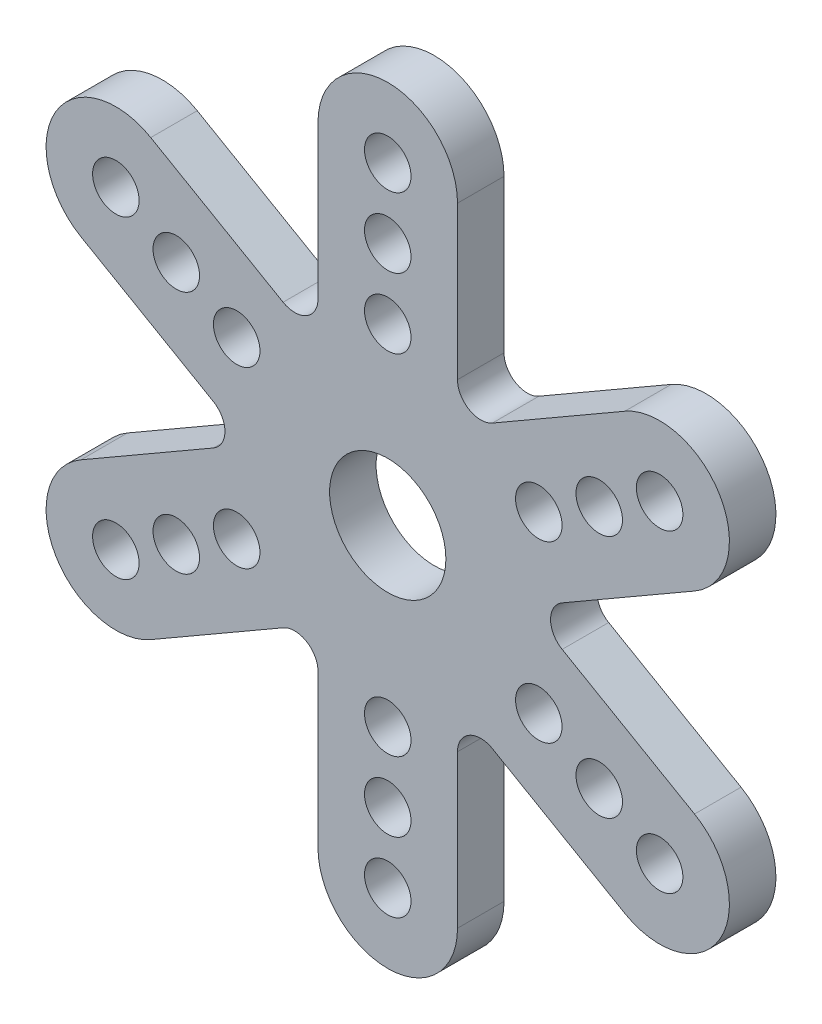
from build123d import *

# Parameters (mm, degrees)
SKETCH1_R      = 2.5
SKETCH1_R_2    = 1
EXTRUDE1_DEPTH = 2
FILLET1_R      = 1


with BuildPart() as part:
    # Sketch1 → Extrude1 (new body)
    with BuildSketch(Plane.XY):
        with BuildLine():
            Line((3, 13.5), (3, 5.196152423))
            Line((3, 5.196152423), (10.191342951, 9.348076211))
            ThreePointArc((10.191342951, 9.348076211), (14.289419162, 8.25), (13.191342951, 4.151923789))
            Line((13.191342951, 4.151923789), (6, 0))
            Line((6, 0), (13.191342951, -4.151923789))
            ThreePointArc((13.191342951, -4.151923789), (14.289419162, -8.25), (10.191342951, -9.348076211))
            Line((10.191342951, -9.348076211), (3, -5.196152423))
            Line((3, -5.196152423), (3, -13.5))
            ThreePointArc((3, -13.5), (0, -16.5), (-3, -13.5))
            Line((-3, -13.5), (-3, -5.196152423))
            Line((-3, -5.196152423), (-10.191342951, -9.348076211))
            ThreePointArc((-10.191342951, -9.348076211), (-14.289419162, -8.25), (-13.191342951, -4.151923789))
            Line((-13.191342951, -4.151923789), (-6, 0))
            Line((-6, 0), (-13.191342951, 4.151923789))
            ThreePointArc((-13.191342951, 4.151923789), (-14.289419162, 8.25), (-10.191342951, 9.348076211))
            Line((-10.191342951, 9.348076211), (-3, 5.196152423))
            Line((-3, 5.196152423), (-3, 13.5))
            ThreePointArc((-3, 13.5), (0, 16.5), (3, 13.5))
        make_face()
        Circle(SKETCH1_R, mode=Mode.SUBTRACT)
        with Locations((0, 7.5)):
            Circle(SKETCH1_R_2, mode=Mode.SUBTRACT)
        with Locations((0, 10.5)):
            Circle(SKETCH1_R_2, mode=Mode.SUBTRACT)
        with Locations((0, 13.5)):
            Circle(SKETCH1_R_2, mode=Mode.SUBTRACT)
        with Locations((-6.495190528, 3.75)):
            Circle(SKETCH1_R_2, mode=Mode.SUBTRACT)
        with Locations((-9.09326674, 5.25)):
            Circle(SKETCH1_R_2, mode=Mode.SUBTRACT)
        with Locations((-11.691342951, 6.75)):
            Circle(SKETCH1_R_2, mode=Mode.SUBTRACT)
        with Locations((-6.495190528, -3.75)):
            Circle(SKETCH1_R_2, mode=Mode.SUBTRACT)
        with Locations((-9.09326674, -5.25)):
            Circle(SKETCH1_R_2, mode=Mode.SUBTRACT)
        with Locations((-11.691342951, -6.75)):
            Circle(SKETCH1_R_2, mode=Mode.SUBTRACT)
        with Locations((0, -7.5)):
            Circle(SKETCH1_R_2, mode=Mode.SUBTRACT)
        with Locations((0, -10.5)):
            Circle(SKETCH1_R_2, mode=Mode.SUBTRACT)
        with Locations((0, -13.5)):
            Circle(SKETCH1_R_2, mode=Mode.SUBTRACT)
        with Locations((6.495190528, -3.75)):
            Circle(SKETCH1_R_2, mode=Mode.SUBTRACT)
        with Locations((9.09326674, -5.25)):
            Circle(SKETCH1_R_2, mode=Mode.SUBTRACT)
        with Locations((11.691342951, -6.75)):
            Circle(SKETCH1_R_2, mode=Mode.SUBTRACT)
        with Locations((6.495190528, 3.75)):
            Circle(SKETCH1_R_2, mode=Mode.SUBTRACT)
        with Locations((9.09326674, 5.25)):
            Circle(SKETCH1_R_2, mode=Mode.SUBTRACT)
        with Locations((11.691342951, 6.75)):
            Circle(SKETCH1_R_2, mode=Mode.SUBTRACT)
    extrude(amount=EXTRUDE1_DEPTH)

    # Fillet1
    fillet1_edges = [part.edges().sort_by_distance(p)[0] for p in [
        (3, 5.196152423, 1),
        (6, 0, 1),
        (3, -5.196152423, 1),
        (-3, -5.196152423, 1),
        (-6, 0, 1),
        (-3, 5.196152423, 1),
    ]]
    fillet(fillet1_edges, radius=FILLET1_R)


solid = part.part
